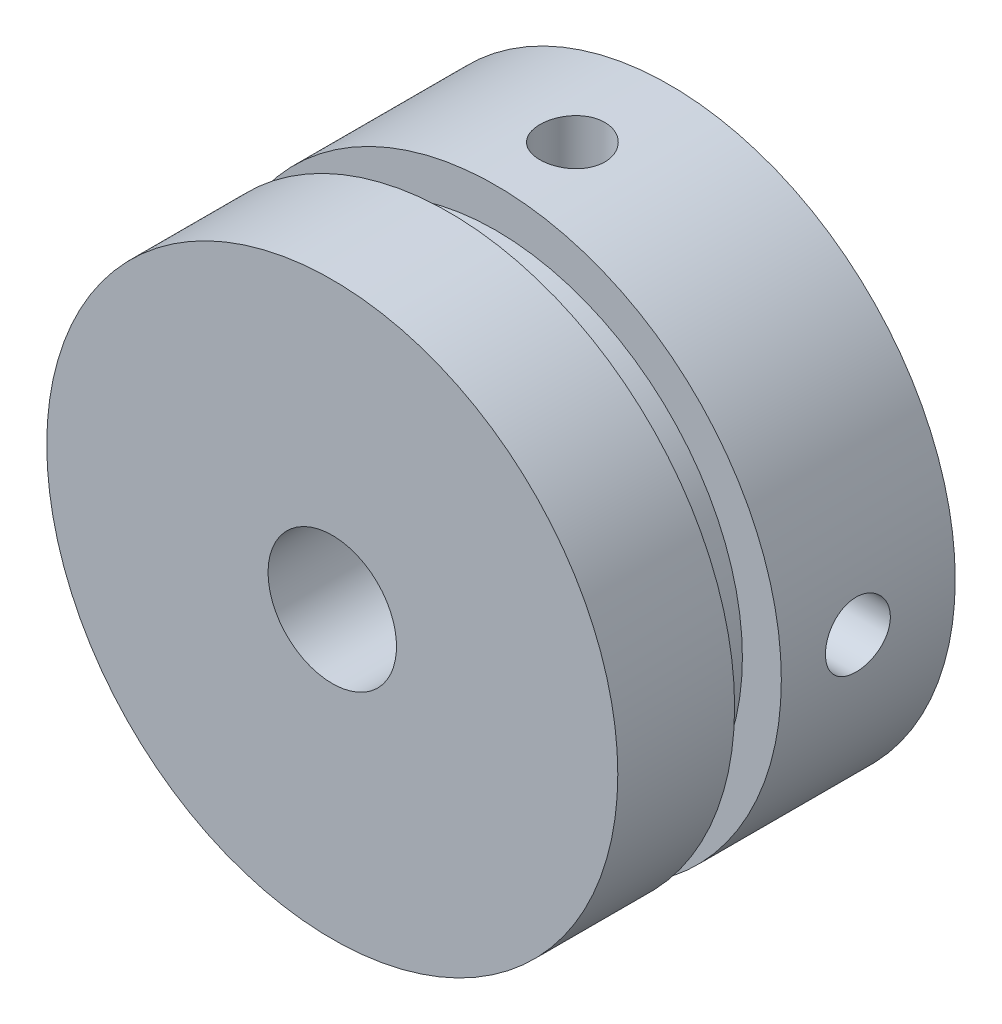
from build123d import *

# Parameters (mm, degrees)
CORTE_EXTRUS_O1_REACH    = 55.104
ESBO_O3_R                = 2.5
PADR_OCIRCULAR1_COUNT    = 4
CORTE_EXTRUS_O2_REACH    = 35.53
ESBO_O5_R                = 4.95
ESBO_O6_R                = 22
ESBO_O6_R_2              = 4.95
RESSALTO_EXTRUS_O1_DEPTH = 6


with BuildPart() as part:
    # Esboço1 → Revolução1 (revolve)
    with BuildSketch(Plane(origin=(0, 0, 0), x_dir=(1, 0, 0), z_dir=(0, 1, 0))):
        Polygon((0, 0), (-22, 0), (-22, 3), (-19, 3), (-19, 6.6), (-22, 6.6), (-22, 20), (-15, 20), (-15, 7.5), (0, 7.5), align=None)
    revolve(axis=Axis((0, 0, 0), (0, 0, -1)))

    # Esboço3 → Corte-extrusão1 (cut, up to next)
    with BuildSketch(Plane.ZY.offset(22), mode=Mode.PRIVATE) as corte_extrus_o1_sk1:
        with Locations((-12.5, 0)):
            Circle(ESBO_O3_R)
    corte_extrus_o1_tool1 = extrude(corte_extrus_o1_sk1.sketch, amount=-CORTE_EXTRUS_O1_REACH, mode=Mode.PRIVATE) & part.part
    corte_extrus_o1 = corte_extrus_o1_tool1.solids().sort_by_distance((-22, 0, -12.5))[0]
    add(corte_extrus_o1, mode=Mode.SUBTRACT)

    # PadrãoCircular1: Corte-extrusão1 ×4 about axis
    padr_ocircular1_axis = Axis((0, 0, -20), (0, 0, 1))
    for i in range(1, PADR_OCIRCULAR1_COUNT):
        add(corte_extrus_o1.rotate(padr_ocircular1_axis, i * 360 / PADR_OCIRCULAR1_COUNT), mode=Mode.SUBTRACT)

    # Esboço5 → Corte-extrusão2 (cut, up to next)
    with BuildSketch(Plane(origin=(0, 0, -7.5), x_dir=(-1, 0, 0), z_dir=(0, 0, -1)), mode=Mode.PRIVATE) as corte_extrus_o2_sk1:
        Circle(ESBO_O5_R)
    corte_extrus_o2_tool1 = extrude(corte_extrus_o2_sk1.sketch, amount=-CORTE_EXTRUS_O2_REACH, mode=Mode.PRIVATE) & part.part
    add(corte_extrus_o2_tool1.solids().sort_by_distance((0, 0, -7.5))[0], mode=Mode.SUBTRACT)

    # Esboço6 → Ressalto-extrusão1 (add)
    with BuildSketch(Plane.XY):
        Circle(ESBO_O6_R)
        Circle(ESBO_O6_R_2, mode=Mode.SUBTRACT)
    extrude(amount=RESSALTO_EXTRUS_O1_DEPTH)


solid = part.part
